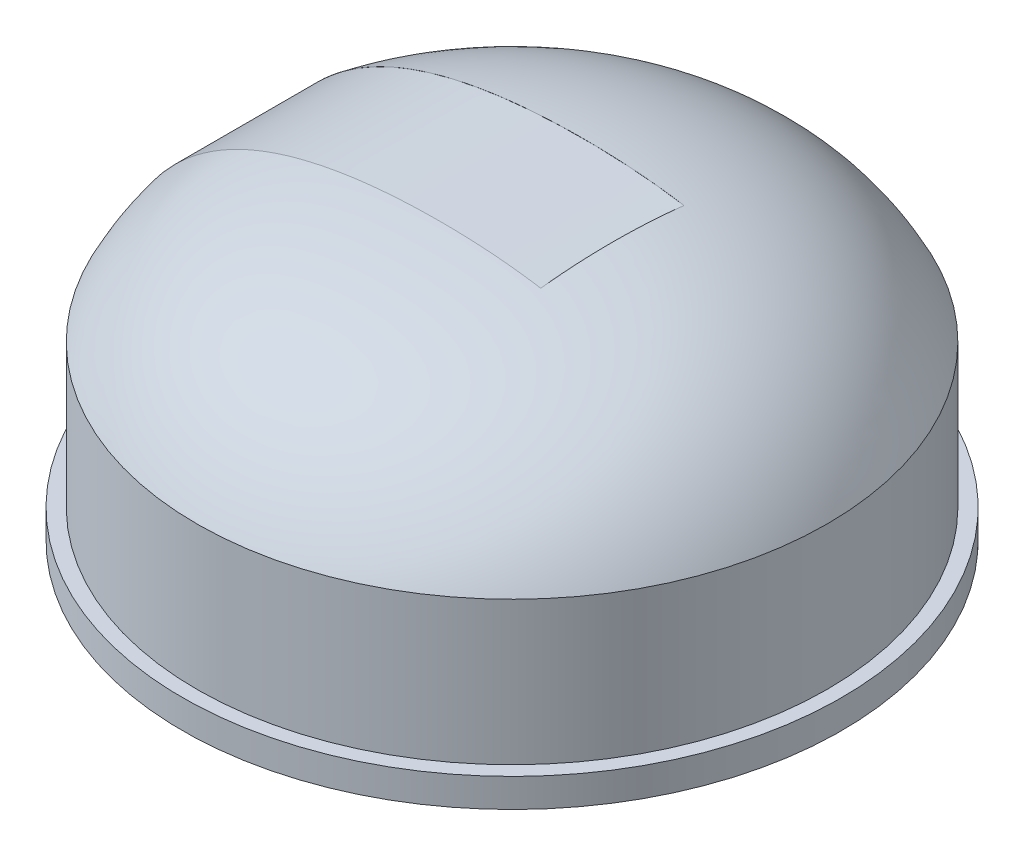
from build123d import *

# Parameters (mm, degrees)
LEVER_SLOT_CUT_DEPTH      = 5
LEVER_SLOT_CUT_DEPTH_BACK = 5
LEVER_SLOT_FILLET_R       = 1
CUP_PLUNGER_PROFILE_W     = 6
CUP_PLUNGER_PROFILE_H     = 4
CUP_PLUNGER_CUT_DEPTH     = 35.591006714
LEVER_EXTRUDE_DEPTH       = 5
LEVER_EXTRUDE_DEPTH_BACK  = 5
FINGER_CATCH_PROFILE_W    = 10
FINGER_CATCH_PROFILE_H    = 2
FINGER_CATCH_DEPTH        = 3
FINGER_CATCH_FILLET_R     = 3
LEVER_START               = -10
LEVER_SHAPE_CUT_DEPTH     = 10
LEVER_FILLET_R            = 2
PIN_HOLE_PROFILE_R        = 0.5
PIN_HOLE_CUT_DEPTH        = 10
PLUNGER_SLOT_PROFILE_W    = 4
PLUNGER_SLOT_PROFILE_H    = 10
PLUNGER_SLOT_CUT_DEPTH    = 10


with BuildPart() as part:
    # Suction Cup Profile → Suction Cup Revolve (revolve)
    with BuildSketch(Plane.XY):
        with BuildLine():
            Line((0, 0), (-23, 0))
            Line((-23, 0), (-23, 2))
            Line((-23, 2), (-22, 2))
            Line((-22, 2), (-22, 12))
            add(Edge.make_bspline(
                [(-22, 12), (-18.421815933, 19.051481144), (-11.029248688, 22), (0, 22)],
                knots=[0, 0, 0, 0, 1, 1, 1, 1], degree=3))
            Line((0, 22), (0, 0))
        make_face()
    revolve(axis=Axis((0, 0, 0), (0, 1, 0)))

    # Lever Slot Profile → Lever Slot Cut (cut, two sides: drawn at the far end of the back side and taken through both)
    with BuildSketch(Plane.XY.offset(-LEVER_SLOT_CUT_DEPTH_BACK)):
        Polygon((7, 10), (-20, 10), (-20, 2), (-23, 2), (-23, 26), (7, 26), align=None)
    extrude(amount=LEVER_SLOT_CUT_DEPTH + LEVER_SLOT_CUT_DEPTH_BACK, mode=Mode.SUBTRACT)

    # Lever Slot Fillet
    lever_slot_fillet_edges = [part.edges().sort_by_distance(p)[0] for p in [
        (7, 10, 0),
        (-20, 2, 0),
        (-20, 10, 0),
    ]]
    fillet(lever_slot_fillet_edges, radius=LEVER_SLOT_FILLET_R)

    # Cup Plunger Profile → Cup Plunger Cut (cut, through all)
    with BuildSketch(Plane(origin=(0, 10, 0), x_dir=(1, 0, 0), z_dir=(0, 1, 0))):
        Rectangle(CUP_PLUNGER_PROFILE_W, CUP_PLUNGER_PROFILE_H)
    extrude(amount=-CUP_PLUNGER_CUT_DEPTH, mode=Mode.SUBTRACT)

    # Pad Slot Profile → Pad Cut Profile (revolve, cut)
    with BuildSketch(Plane.XY):
        with BuildLine():
            Line((0, 9.5), (-17.5, 9.5))
            ThreePointArc((-17.5, 9.5), (-18.914213562, 8.914213562), (-19.5, 7.5))
            Line((-19.5, 7.5), (-19.5, -2.5))
            Line((-19.5, -2.5), (0, -2.5))
            Line((0, -2.5), (0, 9.5))
        make_face()
    revolve(axis=Axis((0, 0, 0), (0, 1, 0)), mode=Mode.SUBTRACT)


with BuildPart() as body_2:
    # Lever Extrude Profile → Lever Extrude (new, two sides: drawn at the far end of the back side and taken through both)
    with BuildSketch(Plane.XY.offset(-LEVER_EXTRUDE_DEPTH_BACK)):
        with BuildLine():
            Line((-19, 10), (6, 10))
            ThreePointArc((6, 10), (6.707106781, 10.292893219), (7, 11))
            Line((7, 11), (7, 21.242307449))
            add(Edge.make_bspline(
                [(7, 21.242307449), (5.685724143, 21.456777565), (4.358857594, 21.595849723), (1.708877373, 21.760019267), (0.387036337, 21.785917476), (-2.251022195, 21.737377334), (-3.567218971, 21.662569282), (-6.192544108, 21.386836768), (-7.501677285, 21.185998254), (-10.10988568, 20.604864637), (-11.383851689, 20.229558725), (-13.228387001, 19.49844466), (-13.832374383, 19.226486682), (-15.014912539, 18.616381153), (-15.596770073, 18.275704638), (-17.259236778, 17.163531752), (-18.26441362, 16.299840579), (-19.378857685, 15.051885465), (-19.594879608, 14.793479293), (-20.007615977, 14.266070663), (-20.599773978, 13.456964359), (-21.113866261, 12.595730264), (-21.424285286, 12)],
                knots=[0, 0, 0, 0, 0.125, 0.125, 0.25, 0.25, 0.375, 0.375, 0.5, 0.5, 0.625, 0.625, 0.6875, 0.6875, 0.75, 0.75, 0.875, 0.875, 0.90625, 0.90625, 0.9375, 1, 1, 1, 1], degree=3))
            Line((-21.424285286, 12), (-21.424285286, 2))
            Line((-21.424285286, 2), (-21, 2))
            ThreePointArc((-21, 2), (-20.292893219, 2.292893219), (-20, 3))
            Line((-20, 3), (-20, 9))
            ThreePointArc((-20, 9), (-19.707106781, 9.707106781), (-19, 10))
        make_face()
    extrude(amount=LEVER_EXTRUDE_DEPTH + LEVER_EXTRUDE_DEPTH_BACK)

    # Finger Catch Profile → Finger Catch (add)
    with BuildSketch(Plane.ZY.offset(21.424285286)):
        with Locations((0, 3)):
            Rectangle(FINGER_CATCH_PROFILE_W, FINGER_CATCH_PROFILE_H)
    extrude(amount=FINGER_CATCH_DEPTH)

    # Finger Catch Fillet
    finger_catch_fillet_edges = [body_2.edges().sort_by_distance(p)[0] for p in [
        (-24.424285286, 3, 5),
        (-24.424285286, 3, -5),
    ]]
    fillet(finger_catch_fillet_edges, radius=FINGER_CATCH_FILLET_R)

    # Lever Shape Profile → Lever Shape Cut (cut)
    with BuildSketch(Plane.XY.offset(5).offset(LEVER_START)):
        with BuildLine():
            Line((-19, 10), (2.560949496, 10))
            add(Edge.make_bspline(
                [(-19.998787914, 9.04922096), (-19.960247668, 10.620318048), (-19.960308906, 12.001719532), (-15.565568962, 17.857367825), (-9.805108275, 19.631012422), (-0.471896304, 20.833531175), (0.805670786, 15.408896049), (0.461682929, 11.477569724), (2.560949496, 10)],
                knots=[0.000763226, 0.000763226, 0.000763226, 0.000763226, 0.074344062, 0.186491464, 0.469322649, 0.695904825, 0.824059419, 1, 1, 1, 1], degree=3))
            ThreePointArc((-19.998787914, 9.04922096), (-19.689484967, 9.724299993), (-19, 10))
        make_face()
    extrude(amount=LEVER_SHAPE_CUT_DEPTH, mode=Mode.SUBTRACT)

    # Lever Fillet
    lever_fillet_edges = [body_2.edges().sort_by_distance(p)[0] for p in [
        (2.560949496, 10, 0),
    ]]
    fillet(lever_fillet_edges, radius=LEVER_FILLET_R)

    # Pin Hole Profile → Pin Hole Cut (cut)
    with BuildSketch(Plane.XY.offset(5)):
        with Locations((4, 17)):
            Circle(PIN_HOLE_PROFILE_R)
    extrude(amount=-PIN_HOLE_CUT_DEPTH, mode=Mode.SUBTRACT)

    # Plunger Slot Profile → Plunger Slot Cut (cut)
    with BuildSketch(Plane(origin=(7, 0, 0), x_dir=(0, 0, -1), z_dir=(1, 0, 0))):
        with Locations((0, 14.242307449)):
            Rectangle(PLUNGER_SLOT_PROFILE_W, PLUNGER_SLOT_PROFILE_H)
    extrude(amount=-PLUNGER_SLOT_CUT_DEPTH, mode=Mode.SUBTRACT)


solid = Compound([part.part, body_2.part])
